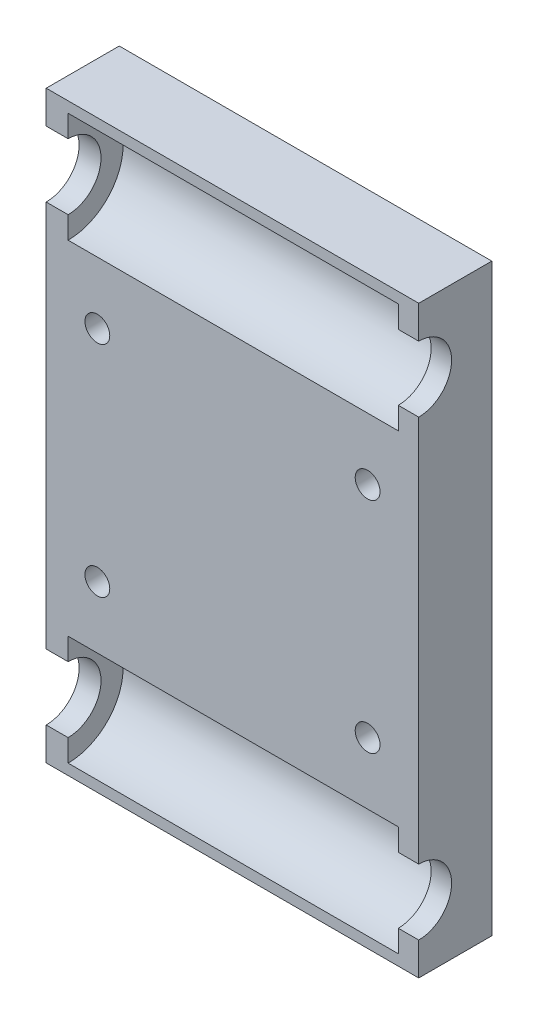
from build123d import *

# Parameters (mm, degrees)
SKETCH1_W           = 51
SKETCH1_H           = 80
SKETCH1_R           = 1.7
BOSS_EXTRUDE1_DEPTH = 10
SKETCH2_R           = 7.525
CUT_EXTRUDE1_DEPTH  = 45.2
SKETCH3_R           = 4.5
CUT_EXTRUDE2_DEPTH  = 96.399161422
SKETCH4_R           = 3
CUT_EXTRUDE3_DEPTH  = 3


with BuildPart() as part:
    # Sketch1 → Boss-Extrude1 (new body)
    with BuildSketch(Plane.XY):
        with Locations((25.5, 40)):
            Rectangle(SKETCH1_W, SKETCH1_H)
        with Locations((7, 55)):
            Circle(SKETCH1_R, mode=Mode.SUBTRACT)
        with Locations((44, 55)):
            Circle(SKETCH1_R, mode=Mode.SUBTRACT)
        with Locations((7, 25)):
            Circle(SKETCH1_R, mode=Mode.SUBTRACT)
        with Locations((44, 25)):
            Circle(SKETCH1_R, mode=Mode.SUBTRACT)
    extrude(amount=BOSS_EXTRUDE1_DEPTH)

    # Sketch2 → Cut-Extrude1 (cut)
    with BuildSketch(Plane.ZY.offset(-3)):
        with Locations((10, 71)):
            Circle(SKETCH2_R)
        with Locations((10, 9)):
            Circle(SKETCH2_R)
    extrude(amount=-CUT_EXTRUDE1_DEPTH, mode=Mode.SUBTRACT)

    # Sketch3 → Cut-Extrude2 (cut, through all)
    with BuildSketch(Plane.ZY):
        with Locations((10, 71)):
            Circle(SKETCH3_R)
        with Locations((10, 9)):
            Circle(SKETCH3_R)
    extrude(amount=-CUT_EXTRUDE2_DEPTH, mode=Mode.SUBTRACT)

    # Sketch4 → Cut-Extrude3 (cut)
    with BuildSketch(Plane(origin=(0, 0, 0), x_dir=(-1, 0, 0), z_dir=(0, 0, -1))):
        with Locations((-44, 55)):
            Circle(SKETCH4_R)
        with Locations((-7, 55)):
            Circle(SKETCH4_R)
        with Locations((-7, 25)):
            Circle(SKETCH4_R)
        with Locations((-44, 25)):
            Circle(SKETCH4_R)
    extrude(amount=-CUT_EXTRUDE3_DEPTH, mode=Mode.SUBTRACT)


solid = part.part
